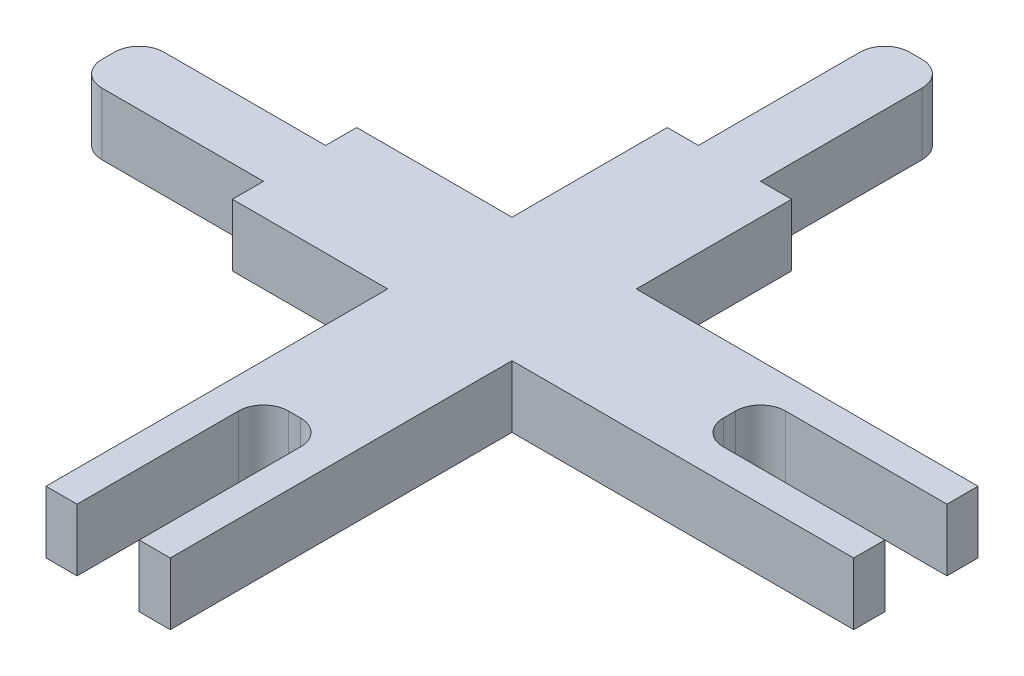
from build123d import *

# Parameters (mm, degrees)
CROQUIS1_W              = 50
CROQUIS1_H              = 10
SALIENTE_EXTRUIR1_DEPTH = 2.5
CORTAR_EXTRUIR1_DEPTH   = 52.23475383
SALIENTE_EXTRUIR2_DEPTH = 5
SALIENTE_EXTRUIR3_DEPTH = 5


with BuildPart() as part:
    # Croquis1 → Saliente-Extruir1 (new, symmetric)
    with BuildSketch(Plane(origin=(0, 0, 0), x_dir=(1, 0, 0), z_dir=(0, 1, 0))):
        with Locations((25, 5)):
            Rectangle(CROQUIS1_W, CROQUIS1_H)
    extrude(amount=SALIENTE_EXTRUIR1_DEPTH, both=True)

    # Croquis2 → Cortar-Extruir1 (cut, through all)
    with BuildSketch(Plane(origin=(0, 2.5, 0), x_dir=(1, 0, 0), z_dir=(0, 1, 0))):
        with BuildLine():
            Line((50, 7.5), (37, 7.5))
            ThreePointArc((37, 7.5), (35.585786438, 6.914213562), (35, 5.5))
            Line((35, 5.5), (35, 4.5))
            ThreePointArc((35, 4.5), (35.585786438, 3.085786438), (37, 2.5))
            Line((37, 2.5), (50, 2.5))
            Line((50, 2.5), (50, 7.5))
        make_face()
    extrude(amount=-CORTAR_EXTRUIR1_DEPTH, mode=Mode.SUBTRACT)

    # Croquis3 → Saliente-Extruir2 (add)
    with BuildSketch(Plane(origin=(0, 2.5, 0), x_dir=(1, 0, 0), z_dir=(0, 1, 0))):
        with BuildLine():
            Line((0, 2.5), (-13, 2.5))
            ThreePointArc((-13, 2.5), (-14.414213562, 3.085786438), (-15, 4.5))
            Line((-15, 4.5), (-15, 5.5))
            ThreePointArc((-15, 5.5), (-14.414213562, 6.914213562), (-13, 7.5))
            Line((-13, 7.5), (0, 7.5))
            Line((0, 7.5), (0, 2.5))
        make_face()
    extrude(amount=-SALIENTE_EXTRUIR2_DEPTH)

    # Croquis4 → Saliente-Extruir3 (add)
    with BuildSketch(Plane(origin=(0, 2.5, 0), x_dir=(1, 0, 0), z_dir=(0, 1, 0))):
        with BuildLine():
            Line((17, 37.5), (18, 37.5))
            ThreePointArc((18, 37.5), (19.414213562, 36.914213562), (20, 35.5))
            Line((20, 35.5), (20, 22.5))
            Line((20, 22.5), (22.5, 22.5))
            Line((22.5, 22.5), (22.5, -27.5))
            Line((22.5, -27.5), (20, -27.5))
            Line((20, -27.5), (20, -14.5))
            ThreePointArc((20, -14.5), (19.414213562, -13.085786438), (18, -12.5))
            Line((18, -12.5), (17, -12.5))
            ThreePointArc((17, -12.5), (15.585786438, -13.085786438), (15, -14.5))
            Line((15, -14.5), (15, -27.5))
            Line((15, -27.5), (12.5, -27.5))
            Line((12.5, -27.5), (12.5, 22.5))
            Line((12.5, 22.5), (15, 22.5))
            Line((15, 22.5), (15, 35.5))
            ThreePointArc((15, 35.5), (15.585786438, 36.914213562), (17, 37.5))
        make_face()
    extrude(amount=-SALIENTE_EXTRUIR3_DEPTH)


solid = part.part
